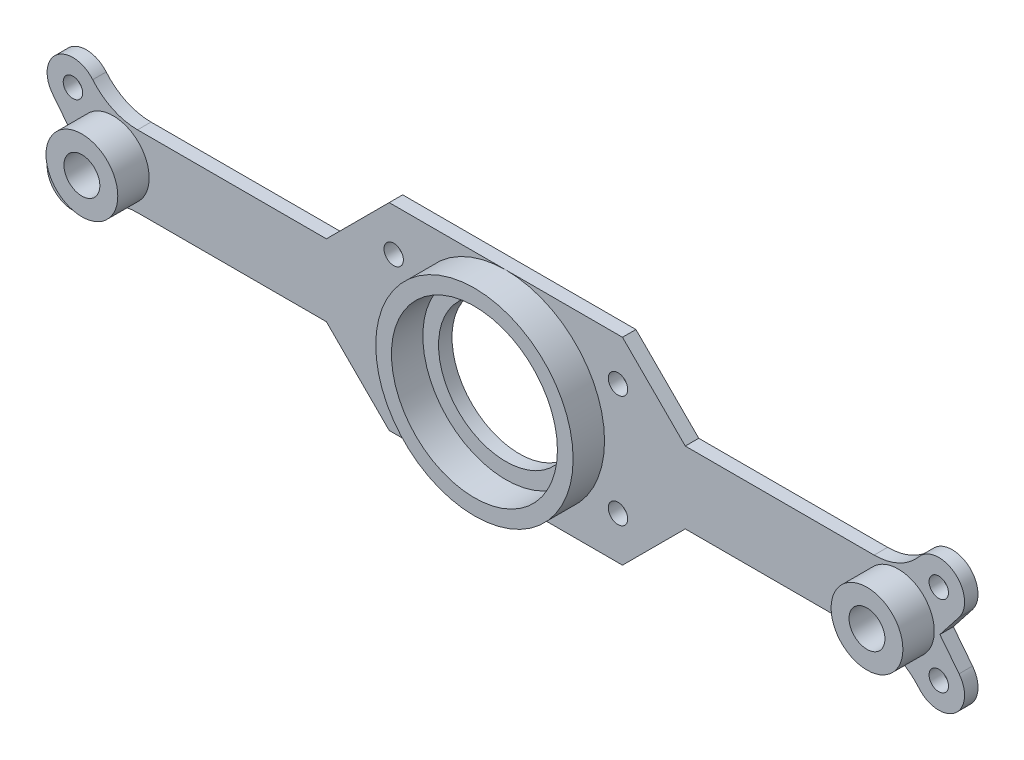
from build123d import *

# Parameters (mm, degrees)
SKETCH1_W               = 204.5
SKETCH1_H               = 62.5
BOSS_EXTRUDE1_DEPTH     = 3
SKETCH2_R               = 8
BOSS_EXTRUDE2_DEPTH     = 7
SKETCH3_R               = 22
BOSS_EXTRUDE3_DEPTH     = 7
SKETCH4_R               = 2.165
CUT_EXTRUDE1_DEPTH      = 108.147678463
CUT_EXTRUDE3_DEPTH      = 7
MIRROR2_COPY_1_SKETCH_R = 2.165
MIRROR2_COPY_1_DEPTH    = 108.147678463
MIRROR2_COPY_2_DEPTH    = 7
MIRROR2_COPY_3_SKETCH_R = 2.165
MIRROR2_COPY_3_DEPTH    = 108.147678463
SKETCH7_R               = 18.5
CUT_EXTRUDE4_DEPTH      = 7
SKETCH11_R              = 4
CUT_EXTRUDE7_DEPTH      = 7
SKETCH12_R              = 15
CUT_EXTRUDE8_DEPTH      = 105.82395957
SKETCH13_R              = 2.165
CUT_EXTRUDE9_DEPTH      = 105.82395957


with BuildPart() as part:
    # Sketch1 → Boss-Extrude1 (new body)
    with BuildSketch(Plane.XY):
        Rectangle(SKETCH1_W, SKETCH1_H)
    extrude(amount=BOSS_EXTRUDE1_DEPTH)

    # Sketch2 → Boss-Extrude2 (add)
    with BuildSketch(Plane.XY.offset(3)):
        with Locations(Location((-87.5, 0, 0), (0, 0, 180))):
            Circle(SKETCH2_R)
        with Locations(Location((87.5, 0, 0), (0, 0, 180))):
            Circle(SKETCH2_R)
    extrude(amount=BOSS_EXTRUDE2_DEPTH)

    # Sketch3 → Boss-Extrude3 (add)
    with BuildSketch(Plane.XY.offset(3)):
        with Locations(Location((0, 0, 0), (0, 0, 180))):
            Circle(SKETCH3_R)
    extrude(amount=BOSS_EXTRUDE3_DEPTH)

    # Sketch4 → Cut-Extrude1 (cut, through all)
    with BuildSketch(Plane.XY.offset(3)):
        with Locations((-96.5, 9)):
            Circle(SKETCH4_R)
        with Locations((-96.5, -9)):
            Circle(SKETCH4_R)
    cut_extrude1 = extrude(amount=-CUT_EXTRUDE1_DEPTH, mode=Mode.SUBTRACT)

    # Sketch6 → Cut-Extrude3 (cut)
    with BuildSketch(Plane.XY.offset(3)):
        with BuildLine():
            Line((-102.25, 0), (-102.25, -9))
            ThreePointArc((-102.25, -9), (-101.935103767, -7.123261595), (-101.024905378, -5.452080705))
            Line((-101.024905378, -5.452080705), (-96.75, 0))
            Line((-96.75, 0), (-102.25, 0))
        make_face()
        with BuildLine():
            Line((-40, -8), (-82.092970466, -8))
            ThreePointArc((-82.092970466, -8), (-87.608403359, -9.22799932), (-92.081844276, -12.68))
            ThreePointArc((-92.081844276, -12.68), (-98.456796437, -14.406796437), (-102.25, -9))
            Line((-102.25, -9), (-102.25, -31.25))
            Line((-102.25, -31.25), (0, -31.25))
            Line((0, -31.25), (0, -22))
            Line((0, -22), (-26, -22))
            Line((-26, -22), (-40, -8))
        make_face()
    cut_extrude3 = extrude(amount=-CUT_EXTRUDE3_DEPTH, mode=Mode.SUBTRACT)

    # Mirror1: Cut-Extrude1, Cut-Extrude3 across plane
    add(cut_extrude1.mirror(Plane(origin=(0, 0, 0), x_dir=(0, 0, 1), z_dir=(1, 0, 0))), mode=Mode.SUBTRACT)
    add(cut_extrude3.mirror(Plane(origin=(0, 0, 0), x_dir=(0, 0, 1), z_dir=(1, 0, 0))), mode=Mode.SUBTRACT)

    # Mirror2: Cut-Extrude3 across plane
    add(cut_extrude3.mirror(Plane.ZX), mode=Mode.SUBTRACT)

    # Mirror2 copy 1 sketch → Mirror2 copy 1 (cut, through all)
    with BuildSketch(Plane(origin=(0, 0, 3), x_dir=(-1, 0, 0), z_dir=(0, 0, 1))):
        with Locations((-96.5, 9)):
            Circle(MIRROR2_COPY_1_SKETCH_R)
        with Locations((-96.5, -9)):
            Circle(MIRROR2_COPY_1_SKETCH_R)
    extrude(amount=-MIRROR2_COPY_1_DEPTH, mode=Mode.SUBTRACT)

    # Mirror2 copy 2 sketch → Mirror2 copy 2 (cut)
    with BuildSketch(Plane(origin=(0, 0, 3), x_dir=(-1, 0, 0), z_dir=(0, 0, 1))):
        with BuildLine():
            Line((-102.25, 0), (-102.25, -9))
            ThreePointArc((-102.25, -9), (-101.935103767, -7.123261595), (-101.024905378, -5.452080705))
            Line((-101.024905378, -5.452080705), (-96.75, 0))
            Line((-96.75, 0), (-102.25, 0))
        make_face()
        with BuildLine():
            Line((-40, -8), (-82.092970466, -8))
            ThreePointArc((-82.092970466, -8), (-87.608403359, -9.22799932), (-92.081844276, -12.68))
            ThreePointArc((-92.081844276, -12.68), (-98.456796437, -14.406796437), (-102.25, -9))
            Line((-102.25, -9), (-102.25, -31.25))
            Line((-102.25, -31.25), (0, -31.25))
            Line((0, -31.25), (0, -22))
            Line((0, -22), (-26, -22))
            Line((-26, -22), (-40, -8))
        make_face()
    extrude(amount=-MIRROR2_COPY_2_DEPTH, mode=Mode.SUBTRACT)

    # Mirror2 copy 3 sketch → Mirror2 copy 3 (cut, through all)
    with BuildSketch(Plane.XY.offset(3)):
        with Locations((-96.5, -9)):
            Circle(MIRROR2_COPY_3_SKETCH_R)
        with Locations((-96.5, 9)):
            Circle(MIRROR2_COPY_3_SKETCH_R)
    extrude(amount=-MIRROR2_COPY_3_DEPTH, mode=Mode.SUBTRACT)

    # Sketch7 → Cut-Extrude4 (cut)
    with BuildSketch(Plane.XY.offset(10)):
        Circle(SKETCH7_R)
    extrude(amount=-CUT_EXTRUDE4_DEPTH, mode=Mode.SUBTRACT)

    # Sketch11 → Cut-Extrude7 (cut)
    with BuildSketch(Plane.XY.offset(10)):
        with Locations((-87.5, 0)):
            Circle(SKETCH11_R)
        with Locations((87.5, 0)):
            Circle(SKETCH11_R)
    extrude(amount=-CUT_EXTRUDE7_DEPTH, mode=Mode.SUBTRACT)

    # Sketch12 → Cut-Extrude8 (cut, through all)
    with BuildSketch(Plane.XY.offset(3)):
        Circle(SKETCH12_R)
    extrude(amount=-CUT_EXTRUDE8_DEPTH, mode=Mode.SUBTRACT)

    # Sketch13 → Cut-Extrude9 (cut, through all)
    with BuildSketch(Plane.XY.offset(3)):
        with Locations((-25, 12.5)):
            Circle(SKETCH13_R)
        with Locations((-25, -12.5)):
            Circle(SKETCH13_R)
        with Locations((25, -12.5)):
            Circle(SKETCH13_R)
        with Locations((25, 12.5)):
            Circle(SKETCH13_R)
    extrude(amount=-CUT_EXTRUDE9_DEPTH, mode=Mode.SUBTRACT)


solid = part.part
